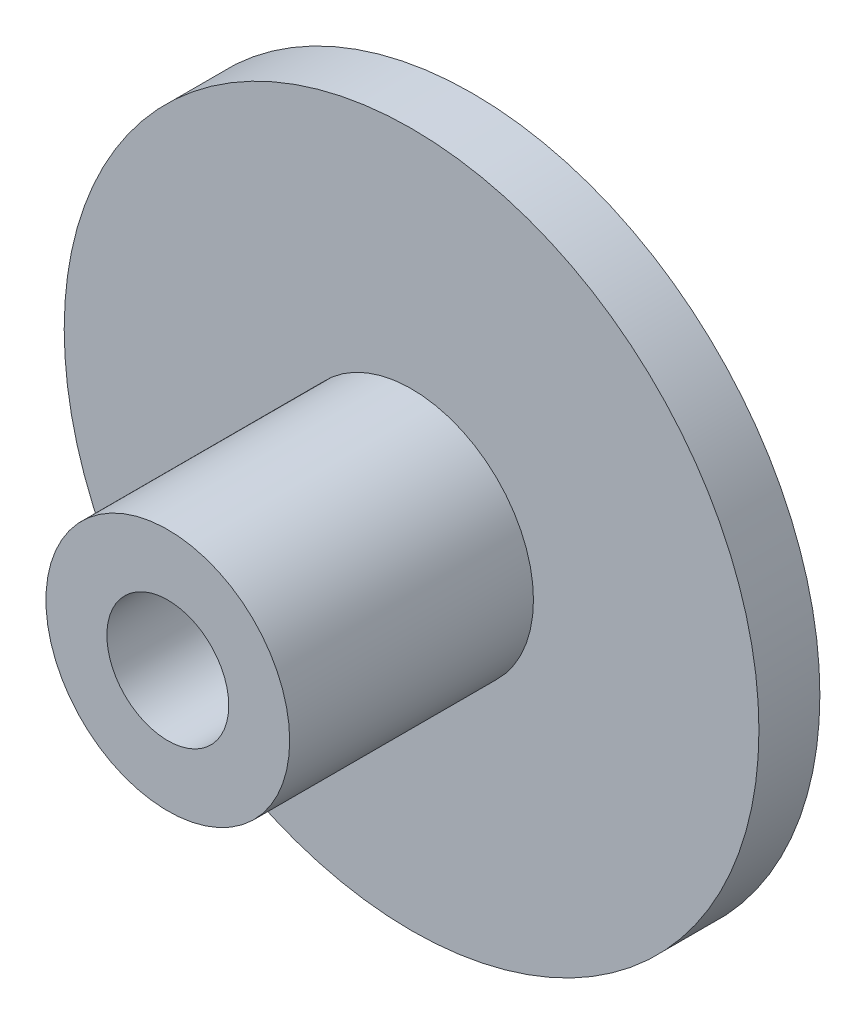
from build123d import *

# Parameters (mm, degrees)
SKETCH1_R           = 28.5
BOSS_EXTRUDE1_DEPTH = 5
SKETCH2_R           = 10
BOSS_EXTRUDE2_DEPTH = 20
SKETCH3_R           = 5
CUT_EXTRUDE1_DEPTH  = 48.428894147


with BuildPart() as part:
    # Sketch1 → Boss-Extrude1 (new body)
    with BuildSketch(Plane.XY):
        Circle(SKETCH1_R)
    extrude(amount=BOSS_EXTRUDE1_DEPTH)

    # Sketch2 → Boss-Extrude2 (add)
    with BuildSketch(Plane.XY.offset(5)):
        Circle(SKETCH2_R)
    extrude(amount=BOSS_EXTRUDE2_DEPTH)

    # Sketch3 → Cut-Extrude1 (cut, through all)
    with BuildSketch(Plane.XY.offset(25)):
        Circle(SKETCH3_R)
    extrude(amount=-CUT_EXTRUDE1_DEPTH, mode=Mode.SUBTRACT)


solid = part.part
